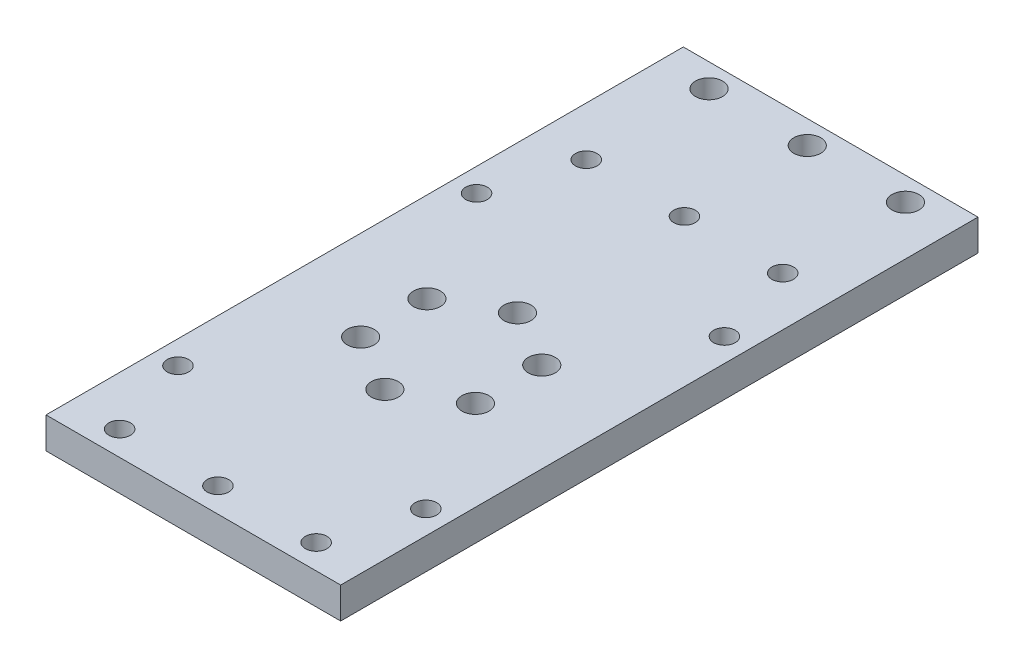
from build123d import *

# Parameters (mm, degrees)
SKETCH1_W               = 60
SKETCH1_H               = 160
BOSS_EXTRUDE1_DEPTH     = 3.175
M4_5_THROUGH_DEPTH      = 6.35
M4_5_THROUGH_DEPTH_BACK = 3.175
SKETCH3_R               = 2.75
SKETCH3_R_2             = 2.2
SKETCH4_R               = 1.3
M3_DRILL_DEPTH          = 8
SKETCH5_R               = 2.2
M4_THROUGH_DEPTH        = 6.35
SKETCH6_R               = 2.75
M5_THROUGH_DEPTH        = 6.35
SKETCH7_W               = 60
SKETCH7_H               = 30.2375
CUT_EXTRUDE1_DEPTH      = 6.35


with BuildPart() as part:
    # Sketch1 → Boss-Extrude1 (new, symmetric)
    with BuildSketch(Plane(origin=(0, 0, 0), x_dir=(1, 0, 0), z_dir=(0, 1, 0))):
        Rectangle(SKETCH1_W, SKETCH1_H)
    extrude(amount=BOSS_EXTRUDE1_DEPTH, both=True)

    # Sketch3 → M4/5_through (cut, two sides: drawn at the far end of the back side and taken through both)
    with BuildSketch(Plane(origin=(0, 0, 0), x_dir=(1, 0, 0), z_dir=(0, 1, 0)).offset(-M4_5_THROUGH_DEPTH_BACK)):
        with Locations(Location((20, 75.2375, 0), (0, 0, 270))):
            Circle(SKETCH3_R)
        with Locations(Location((20, 50.2375, 0), (0, 0, 270))):
            Circle(SKETCH3_R_2)
        with Locations(Location((-20, 50.2375, 0), (0, 0, 270))):
            Circle(SKETCH3_R_2)
        with Locations(Location((-20, 75.2375, 0), (0, 0, 270))):
            Circle(SKETCH3_R)
        with Locations(Location((0, 75.2375, 0), (0, 0, 270))):
            Circle(SKETCH3_R)
        with Locations(Location((0, 50.2375, 0), (0, 0, 270))):
            Circle(SKETCH3_R_2)
        with Locations(Location((20, -44.7625, 0), (0, 0, 270))):
            Circle(SKETCH3_R_2)
        with Locations(Location((-20, -44.7625, 0), (0, 0, 270))):
            Circle(SKETCH3_R_2)
        with Locations(Location((0, -44.7625, 0), (0, 0, 270))):
            Circle(SKETCH3_R_2)
    extrude(amount=M4_5_THROUGH_DEPTH + M4_5_THROUGH_DEPTH_BACK, mode=Mode.SUBTRACT)

    # Sketch4 → M3_DRILL (cut)
    with BuildSketch(Plane(origin=(0, 0, -80), x_dir=(-1, 0, 0), z_dir=(0, 0, -1))):
        with Locations((-12, 0)):
            Circle(SKETCH4_R)
        with Locations(Location((12, 0, 0), (0, 0, 180))):
            Circle(SKETCH4_R)
    extrude(amount=-M3_DRILL_DEPTH, mode=Mode.SUBTRACT)

    # Sketch5 → M4_through (cut)
    with BuildSketch(Plane(origin=(0, 3.175, 0), x_dir=(1, 0, 0), z_dir=(0, 1, 0))):
        with Locations(Location((-25.2375, -27.6625, 0), (0, 0, 270))):
            Circle(SKETCH5_R)
        with Locations(Location((25.2375, -27.6625, 0), (0, 0, 270))):
            Circle(SKETCH5_R)
        with Locations(Location((25.2375, 33.1375, 0), (0, 0, 270))):
            Circle(SKETCH5_R)
        with Locations(Location((-25.2375, 33.1375, 0), (0, 0, 270))):
            Circle(SKETCH5_R)
    extrude(amount=-M4_THROUGH_DEPTH, mode=Mode.SUBTRACT)

    # Sketch6 → M5_through (cut)
    with BuildSketch(Plane(origin=(0, 3.175, 0), x_dir=(1, 0, 0), z_dir=(0, 1, 0))):
        with Locations(Location((0, 16.2375, 0), (0, 0, 270))):
            Circle(SKETCH6_R)
        with Locations(Location((11.691342951, 9.4875, 0), (0, 0, 270))):
            Circle(SKETCH6_R)
        with Locations(Location((11.691342951, -4.0125, 0), (0, 0, 270))):
            Circle(SKETCH6_R)
        with Locations(Location((0, -10.7625, 0), (0, 0, 270))):
            Circle(SKETCH6_R)
        with Locations(Location((-11.691342951, -4.0125, 0), (0, 0, 270))):
            Circle(SKETCH6_R)
        with Locations(Location((-11.691342951, 9.4875, 0), (0, 0, 270))):
            Circle(SKETCH6_R)
    extrude(amount=-M5_THROUGH_DEPTH, mode=Mode.SUBTRACT)

    # Sketch7 → Cut-Extrude1 (cut)
    with BuildSketch(Plane(origin=(0, 3.175, 0), x_dir=(1, 0, 0), z_dir=(0, 1, 0))):
        with Locations((0, -64.88125)):
            Rectangle(SKETCH7_W, SKETCH7_H)
    extrude(amount=-CUT_EXTRUDE1_DEPTH, mode=Mode.SUBTRACT)


solid = part.part
